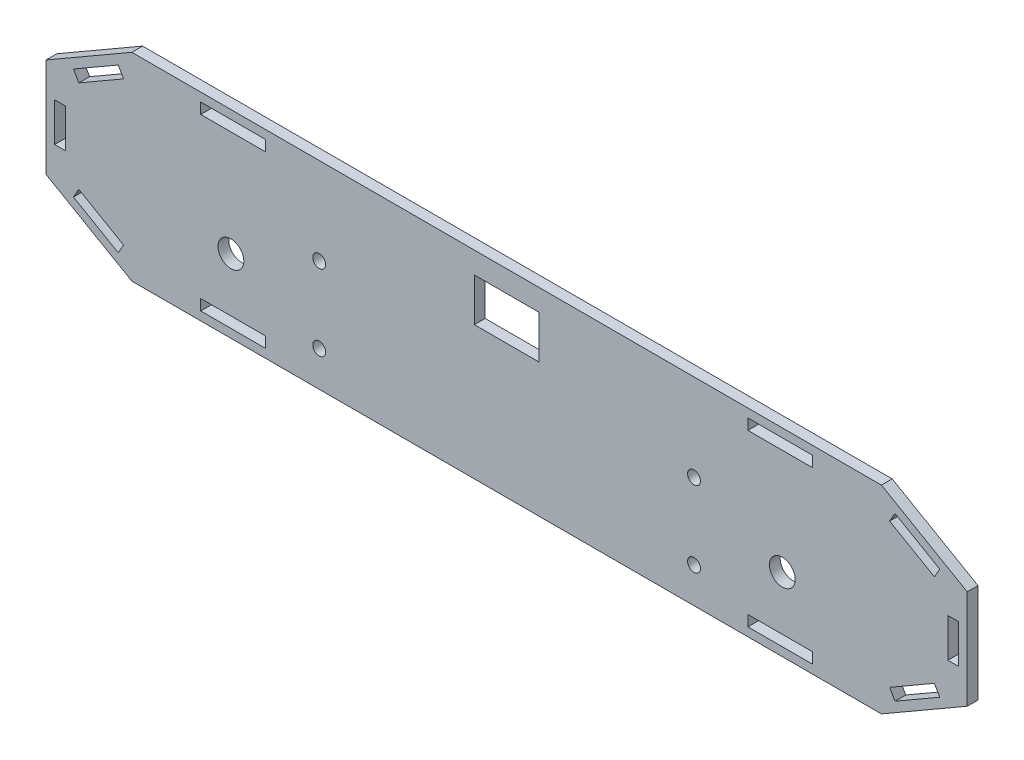
from build123d import *

# Parameters (mm, degrees)
SKETCH1_R           = 1.5
SKETCH1_R_2         = 3
BOSS_EXTRUDE1_DEPTH = 2.5
SKETCH2_W           = 15
SKETCH2_H           = 2.5
CUT_EXTRUDE1_DEPTH  = 3
CUT_EXTRUDE2_DEPTH  = 3
SKETCH4_W           = 2.5
SKETCH4_H           = 9
CUT_EXTRUDE3_DEPTH  = 12
SKETCH5_W           = 15
SKETCH5_H           = 10
CUT_EXTRUDE4_DEPTH  = 2.5


with BuildPart() as part:
    # Sketch1 → Boss-Extrude1 (new body)
    with BuildSketch(Plane.XY):
        Polygon((87, 23), (106.918584287, 11.5), (106.918584287, -11.5), (87, -23), (-87, -23), (-106.918584287, -11.5), (-106.918584287, 11.5), (-87, 23), align=None)
        with Locations((43.5, -14.8)):
            Circle(SKETCH1_R, mode=Mode.SUBTRACT)
        with Locations((-43.5, 2.8)):
            Circle(SKETCH1_R, mode=Mode.SUBTRACT)
        with Locations((-43.5, -14.8)):
            Circle(SKETCH1_R, mode=Mode.SUBTRACT)
        with Locations((-64, -6)):
            Circle(SKETCH1_R_2, mode=Mode.SUBTRACT)
        with Locations((43.5, 2.8)):
            Circle(SKETCH1_R, mode=Mode.SUBTRACT)
        with Locations((64, -6)):
            Circle(SKETCH1_R_2, mode=Mode.SUBTRACT)
    extrude(amount=BOSS_EXTRUDE1_DEPTH)

    # Sketch2 → Cut-Extrude1 (cut)
    with BuildSketch(Plane.XY.offset(2.5)):
        with Locations((-63.5, 19.75)):
            Rectangle(SKETCH2_W, SKETCH2_H)
        with Locations((-63.5, -19.75)):
            Rectangle(SKETCH2_W, SKETCH2_H)
        with Locations((63.5, -19.75)):
            Rectangle(SKETCH2_W, SKETCH2_H)
        with Locations((63.5, 19.75)):
            Rectangle(SKETCH2_W, SKETCH2_H)
    extrude(amount=-CUT_EXTRUDE1_DEPTH, mode=Mode.SUBTRACT)

    # Sketch3 → Cut-Extrude2 (cut)
    with BuildSketch(Plane.XY.offset(2.5)):
        Polygon((-90.151279442, 18.871206889), (-88.901279442, 16.70614338), (-99.293584287, 10.70614338), (-100.543584287, 12.871206889), align=None)
        Polygon((-88.901279442, -16.70614338), (-90.151279442, -18.871206889), (-100.543584287, -12.871206889), (-99.293584287, -10.70614338), align=None)
        Polygon((99.293584287, -10.70614338), (100.543584287, -12.871206889), (90.151279442, -18.871206889), (88.901279442, -16.70614338), align=None)
        Polygon((100.543584287, 12.871206889), (99.293584287, 10.70614338), (88.901279442, 16.70614338), (90.151279442, 18.871206889), align=None)
    extrude(amount=-CUT_EXTRUDE2_DEPTH, mode=Mode.SUBTRACT)

    # Sketch4 → Cut-Extrude3 (cut)
    with BuildSketch(Plane.XY.offset(2.5)):
        with Locations((-103.668584287, 0)):
            Rectangle(SKETCH4_W, SKETCH4_H)
        with Locations((103.668584287, 0)):
            Rectangle(SKETCH4_W, SKETCH4_H)
    extrude(amount=-CUT_EXTRUDE3_DEPTH, mode=Mode.SUBTRACT)

    # Sketch5 → Cut-Extrude4 (cut)
    with BuildSketch(Plane.XY.offset(2.5)):
        with Locations((0, 13)):
            Rectangle(SKETCH5_W, SKETCH5_H)
    extrude(amount=-CUT_EXTRUDE4_DEPTH, mode=Mode.SUBTRACT)


solid = part.part
